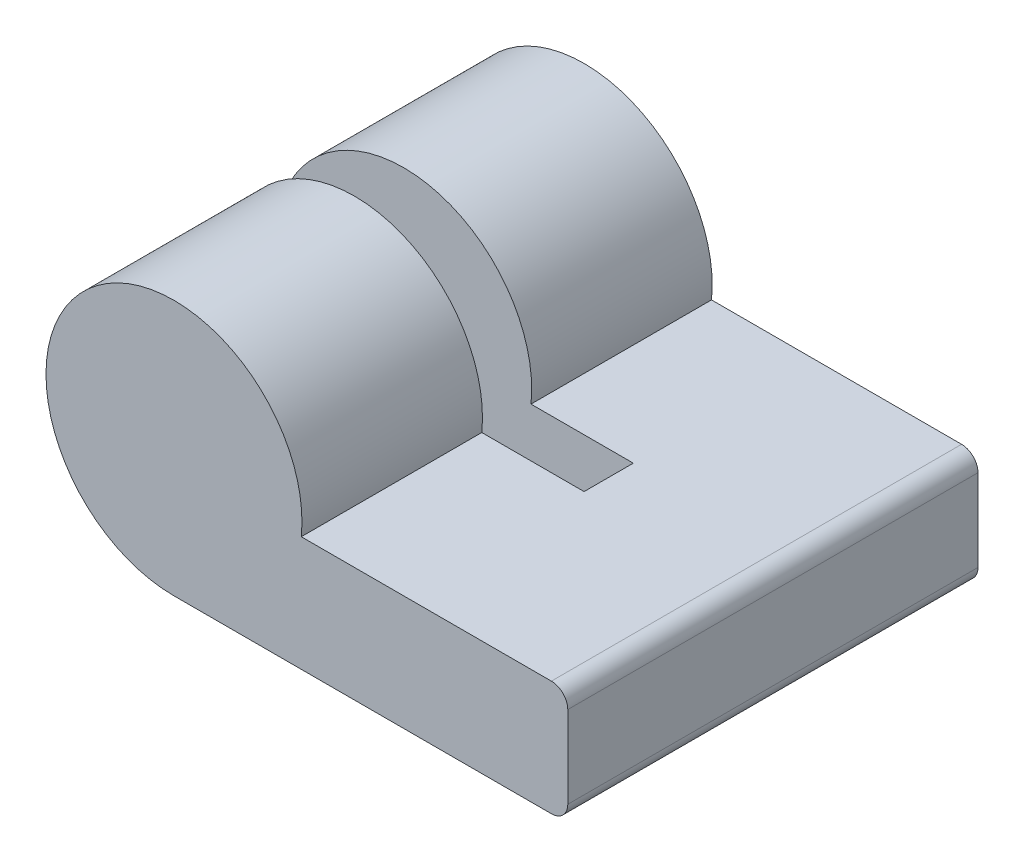
from build123d import *

# Parameters (mm, degrees)
BASE_EXTRUSION_DEPTH    = 12.5
CONG_1_R                = 0.5
ESQUISSE2_R             = 30
ENL_V_MAT_EXTRU_1_DEPTH = 1.5


with BuildPart() as part:
    # Esquisse1 → Base-Extrusion (new body)
    with BuildSketch(Plane.XY):
        with BuildLine():
            Line((0, -3.9), (12, -3.9))
            Line((12, -3.9), (12, -0.4))
            Line((12, -0.4), (3.879432948, -0.4))
            ThreePointArc((3.879432948, -0.4), (-2.612470096, 2.895686447), (0, -3.9))
        make_face()
    extrude(amount=BASE_EXTRUSION_DEPTH)

    # Congé1
    cong_1_edges = [part.edges().sort_by_distance(p)[0] for p in [
        (12, -3.9, 6.25),
        (12, -0.4, 6.25),
    ]]
    fillet(cong_1_edges, radius=CONG_1_R)

    # Esquisse2 → Enlèv. mat.-Extru.1 (cut)
    with BuildSketch(Plane.XY.offset(7)):
        with Locations((-15, 20)):
            Circle(ESQUISSE2_R)
    extrude(amount=-ENL_V_MAT_EXTRU_1_DEPTH, mode=Mode.SUBTRACT)


solid = part.part
